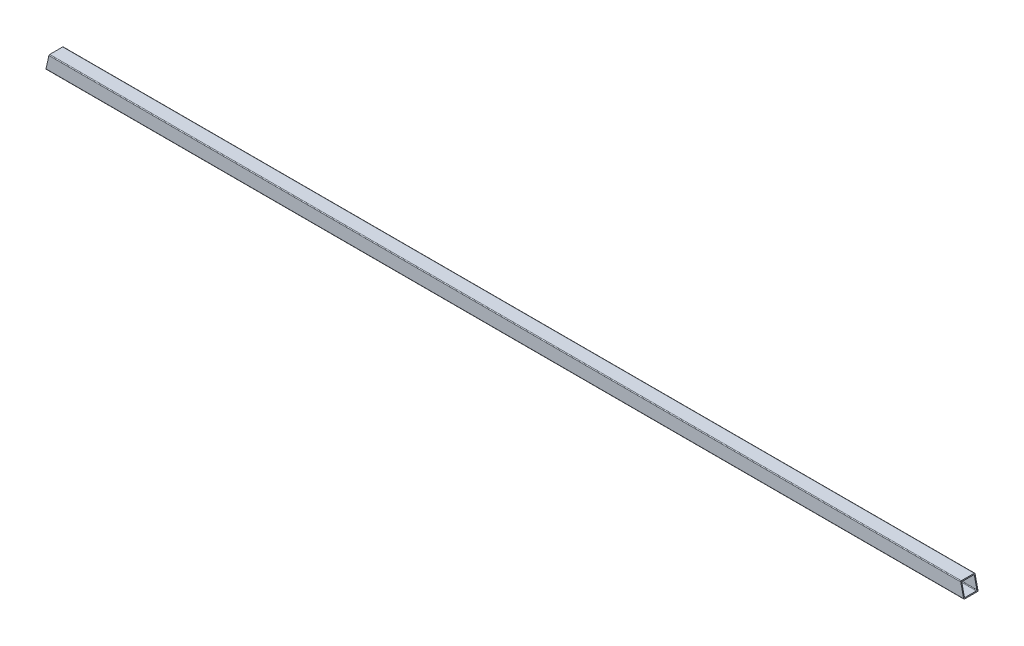
from build123d import *

# Parameters (mm, degrees)
BOSS_EXTRUDE1_DEPTH      = 812.8
BOSS_EXTRUDE1_DEPTH_BACK = 812.8
CUT_EXTRUDE1_DEPTH       = 814.295942447


with BuildPart() as part:
    # Sketch4 → Boss-Extrude1 (new, two sides: drawn at the far end of the back side and taken through both)
    with BuildSketch(Plane(origin=(0, 0, 0), x_dir=(0, 0, -1), z_dir=(1, 0, 0)).offset(-BOSS_EXTRUDE1_DEPTH_BACK)):
        with BuildLine():
            Line((12.7, -11.43), (12.7, 11.43))
            ThreePointArc((12.7, 11.43), (12.328025612, 12.328025612), (11.43, 12.7))
            Line((11.43, 12.7), (-11.43, 12.7))
            ThreePointArc((-11.43, 12.7), (-12.328025612, 12.328025612), (-12.7, 11.43))
            Line((-12.7, 11.43), (-12.7, -11.43))
            ThreePointArc((-12.7, -11.43), (-12.328025612, -12.328025612), (-11.43, -12.7))
            Line((-11.43, -12.7), (11.43, -12.7))
            ThreePointArc((11.43, -12.7), (12.328025612, -12.328025612), (12.7, -11.43))
        make_face()
        with BuildLine():
            Line((11.049, 9.9441), (11.049, -9.9441))
            ThreePointArc((11.049, -9.9441), (10.725382283, -10.725382283), (9.9441, -11.049))
            Line((9.9441, -11.049), (-9.9441, -11.049))
            ThreePointArc((-9.9441, -11.049), (-10.725382283, -10.725382283), (-11.049, -9.9441))
            Line((-11.049, -9.9441), (-11.049, 9.9441))
            ThreePointArc((-11.049, 9.9441), (-10.725382283, 10.725382283), (-9.9441, 11.049))
            Line((-9.9441, 11.049), (9.9441, 11.049))
            ThreePointArc((9.9441, 11.049), (10.725382283, 10.725382283), (11.049, 9.9441))
        make_face(mode=Mode.SUBTRACT)
    extrude(amount=BOSS_EXTRUDE1_DEPTH + BOSS_EXTRUDE1_DEPTH_BACK)

    # Sketch5 → Cut-Extrude1 (cut, through all)
    with BuildSketch(Plane.XY.offset(12.7)):
        Polygon((812.8, -12.7), (807.168955569, 12.7), (812.8, 12.7), align=None)
    cut_extrude1 = extrude(amount=-CUT_EXTRUDE1_DEPTH, mode=Mode.SUBTRACT)

    # Mirror1: Cut-Extrude1 across plane
    add(cut_extrude1.mirror(Plane(origin=(0, 0, 0), x_dir=(0, 0, 1), z_dir=(1, 0, 0))), mode=Mode.SUBTRACT)


solid = part.part
